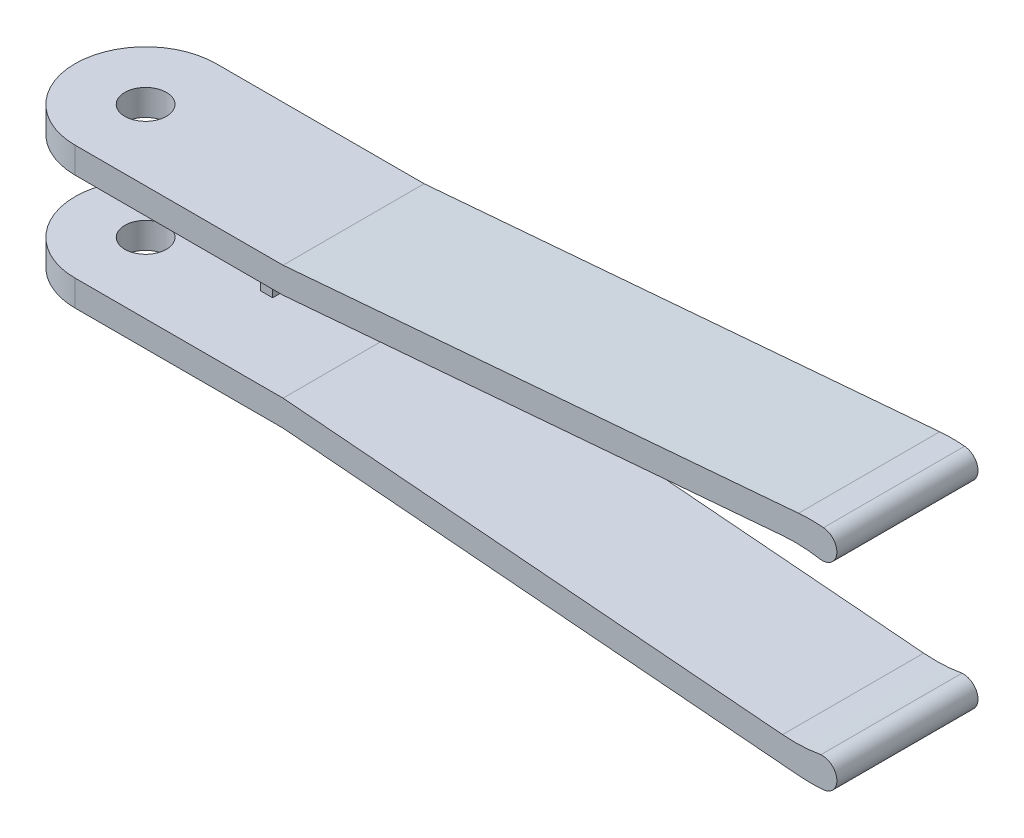
from build123d import *

# Parameters (mm, degrees)
SKETCH_1_R           = 4.75
SKETCH_1_R_2         = 1.4
EXTRUDE_1_DEPTH      = 1.75
EXTRUDE_2_DEPTH      = 4.75
EXTRUDE_2_DEPTH_BACK = 4.75
SKETCH_3_R           = 1.4
CUT_EXTRUDE_1_DEPTH  = 71.22508455
FILLET_1_R           = 10
FILLET_2_R           = 10
SKETCH_5_W           = 18.718698013
SKETCH_5_H           = 4.522568897
CUT_EXTRUDE_3_DEPTH  = 71.796323339
CUT_EXTRUDE_4_DEPTH  = 53.363072215
CUT_EXTRUDE_5_DEPTH  = 53.363072215
SKETCH_10_W          = 0.8
SKETCH_10_H          = 4
EXTRUDE_3_DEPTH      = 3


with BuildPart() as part:
    # 草图1 → 凸台-拉伸1 (new body)
    with BuildSketch(Plane(origin=(0, 0, 0), x_dir=(1, 0, 0), z_dir=(0, 1, 0))):
        Circle(SKETCH_1_R)
        Circle(SKETCH_1_R_2, mode=Mode.SUBTRACT)
    extrude(amount=EXTRUDE_1_DEPTH)

    # 草图2 → 凸台-拉伸2 (add, two sides: drawn at the far end of the back side and taken through both)
    with BuildSketch(Plane.XY.offset(-EXTRUDE_2_DEPTH_BACK)):
        Polygon((14, 1.75), (50, 4.75), (70, 1.2), (70, 0), (65.316834236, 0), (48.921679528, 2.910139961), (14, 0), (0, 0), (0, 1.75), align=None)
    extrude(amount=EXTRUDE_2_DEPTH + EXTRUDE_2_DEPTH_BACK)

    # 草图3 → 切除-拉伸1 (cut, through all)
    with BuildSketch(Plane(origin=(0, 1.75, 0), x_dir=(1, 0, 0), z_dir=(0, 1, 0))):
        Circle(SKETCH_3_R)
    extrude(amount=-CUT_EXTRUDE_1_DEPTH, mode=Mode.SUBTRACT)

    # 圆角1
    fillet_1_edges = [part.edges().sort_by_distance(p)[0] for p in [
        (50, 4.75, 0),
        (48.921679528, 2.910139961, 0),
    ]]
    fillet(fillet_1_edges, radius=FILLET_1_R)

    # 圆角2
    fillet_2_edges = [part.edges().sort_by_distance(p)[0] for p in [
        (65.316834236, 0, 0),
    ]]
    fillet(fillet_2_edges, radius=FILLET_2_R)

    # 草图5 → 切除-拉伸3 (cut, through all)
    with BuildSketch(Plane.XY.offset(4.75)):
        with Locations((60.640650994, 2.261284449)):
            Rectangle(SKETCH_5_W, SKETCH_5_H)
    extrude(amount=-CUT_EXTRUDE_3_DEPTH, mode=Mode.SUBTRACT)

    # 草图6 → 切除-拉伸4 (cut, through all)
    with BuildSketch(Plane.XY.offset(4.75)):
        with BuildLine():
            Line((51.281301987, 4.522568897), (51.281301987, 3.662250428))
            ThreePointArc((51.281301987, 3.662250428), (51.022669477, 4.326231546), (50.383057367, 4.640330335))
            ThreePointArc((50.383057367, 4.640330335), (50.833513908, 4.591626686), (51.281301987, 4.522568897))
        make_face()
    extrude(amount=-CUT_EXTRUDE_4_DEPTH, mode=Mode.SUBTRACT)

    # 草图7 → 切除-拉伸5 (cut, through all)
    with BuildSketch(Plane.XY.offset(4.75)):
        with BuildLine():
            Line((51.281301987, 2.491306974), (51.281301987, 3.662250428))
            ThreePointArc((51.281301987, 3.662250428), (50.938888433, 2.917268377), (50.150530669, 2.692018883))
            Line((50.150530669, 2.692018883), (50.202981515, 2.682708858))
            Line((50.202981515, 2.682708858), (51.281301987, 2.491306974))
        make_face()
    extrude(amount=-CUT_EXTRUDE_5_DEPTH, mode=Mode.SUBTRACT)

    # 草图10 → 凸台-拉伸3 (add)
    with BuildSketch(Plane.XZ):
        with Locations((7.4, -2.75)):
            Rectangle(SKETCH_10_W, SKETCH_10_H)
    extrude(amount=EXTRUDE_3_DEPTH)

    # 镜向1: part across plane


with BuildPart() as part_1:
    add(part.part)
    add(part.part.mirror(Plane.ZX.offset(-3)))


solid = part_1.part
